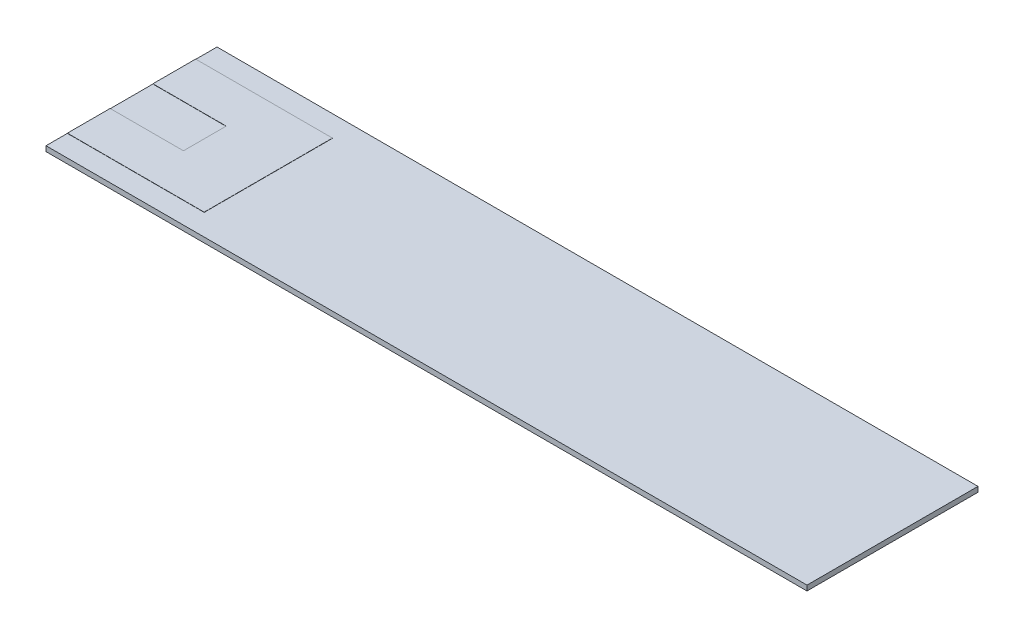
from build123d import *

# Parameters (mm, degrees)
BOSS_EXTRUDE1_DEPTH      = 0.0001
BOSS_EXTRUDE1_DEPTH_BACK = 0.3
SKETCH1_W                = 44.5
SKETCH1_H                = 10
BOSS_EXTRUDE3_DEPTH      = 0.0126


with BuildPart() as part:
    # Sketch1 → Boss-Extrude1 (new, two sides: drawn at the far end of the back side and taken through both)
    with BuildSketch(Plane(origin=(0, 0, 0), x_dir=(1, 0, 0), z_dir=(0, 1, 0)).offset(-BOSS_EXTRUDE1_DEPTH_BACK)):
        with Locations((52.25, 0)):
            Rectangle(SKETCH1_W, SKETCH1_H)
    extrude(amount=BOSS_EXTRUDE1_DEPTH + BOSS_EXTRUDE1_DEPTH_BACK)

    # Sketch2 → Boss-Extrude3 (add)
    with BuildSketch(Plane(origin=(0, 0.0001, 0), x_dir=(1, 0, 0), z_dir=(0, 1, 0))):
        Polygon((30, 3.75), (38, 3.75), (38, -3.75), (30, -3.75), (30, -1.25), (34.288261115, -1.25), (34.288261115, 1.25), (30, 1.25), align=None)
    extrude(amount=BOSS_EXTRUDE3_DEPTH)


solid = part.part
